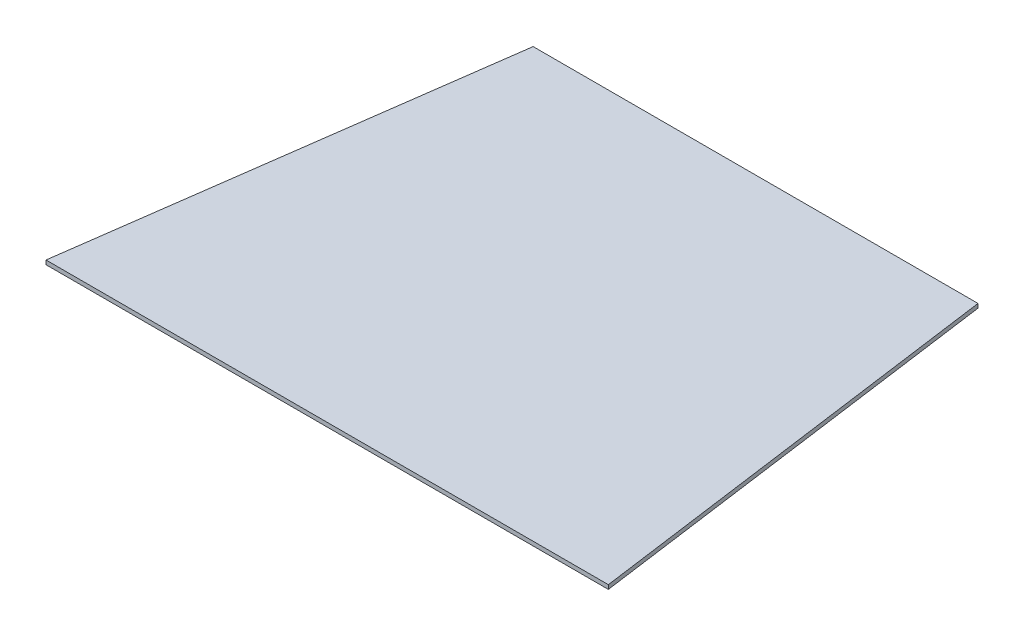
from build123d import *

# Parameters (mm, degrees)
SKETCH1_W           = 254
SKETCH1_H           = 165.1
BOSS_EXTRUDE1_DEPTH = 1.5875
CUT_EXTRUDE1_DEPTH  = 1.5875


with BuildPart() as part:
    # Sketch1 → Boss-Extrude1 (new body)
    with BuildSketch(Plane(origin=(0, 0, 0), x_dir=(1, 0, 0), z_dir=(0, 1, 0))):
        with Locations((8.593984962, 10.296867168)):
            Rectangle(SKETCH1_W, SKETCH1_H)
    extrude(amount=BOSS_EXTRUDE1_DEPTH)

    # Sketch2 → Cut-Extrude1 (cut)
    with BuildSketch(Plane(origin=(0, 1.5875, 0), x_dir=(1, 0, 0), z_dir=(0, 1, 0))):
        Polygon((-118.406015038, 92.846867168), (-77.131015038, 92.846867168), (-99.774548191, -72.253132832), (-118.406015038, -72.253132832), align=None)
        Polygon((135.593984962, 92.846867168), (94.318984962, 92.846867168), (116.962518034, -72.253132832), (135.593984962, -72.253132832), align=None)
    extrude(amount=-CUT_EXTRUDE1_DEPTH, mode=Mode.SUBTRACT)


solid = part.part
